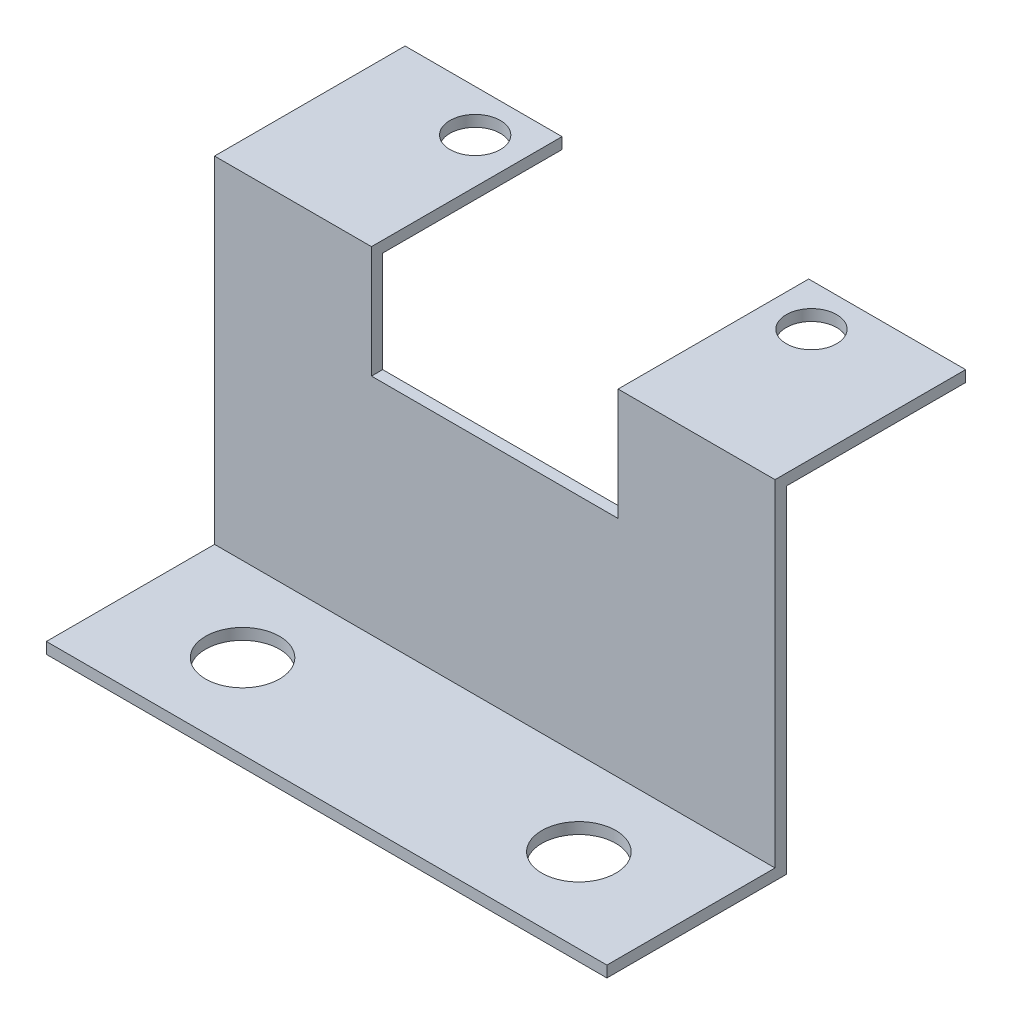
from build123d import *

# Parameters (mm, degrees)
BOSS_EXTRUDE1_DEPTH  = 25
SKETCH2_W            = 22
SKETCH2_H            = 17
CUT_EXTRUDE1_DEPTH   = 10
M4_CLEARANCE_HOLE1_D = 4.5
M6_CLEARANCE_HOLE1_D = 6.6


with BuildPart() as part:
    # Sketch1 → Boss-Extrude1 (new, symmetric)
    with BuildSketch(Plane(origin=(0, 0, 0), x_dir=(0, 0, -1), z_dir=(1, 0, 0))):
        Polygon((0, 0), (16, 0), (16, 30), (32, 30), (32, 31), (15, 31), (15, 1), (0, 1), align=None)
    extrude(amount=BOSS_EXTRUDE1_DEPTH, both=True)

    # Sketch2 → Cut-Extrude1 (cut)
    with BuildSketch(Plane(origin=(0, 31, 0), x_dir=(1, 0, 0), z_dir=(0, 1, 0))):
        with Locations((0, 23.5)):
            Rectangle(SKETCH2_W, SKETCH2_H)
    extrude(amount=-CUT_EXTRUDE1_DEPTH, mode=Mode.SUBTRACT)

    # M4 Clearance Hole1 (through all)
    with Locations(Plane(origin=(0, 31, 0), x_dir=(1, 0, 0), z_dir=(0, 1, 0))):
        with Locations((-15, 28.25), (15, 28.25)):
            Hole(M4_CLEARANCE_HOLE1_D / 2)

    # M6 Clearance Hole1 (through all)
    with Locations(Plane(origin=(0, 1, 0), x_dir=(1, 0, 0), z_dir=(0, 1, 0))):
        with Locations((-15, 7.5), (15, 7.5)):
            Hole(M6_CLEARANCE_HOLE1_D / 2)


solid = part.part
